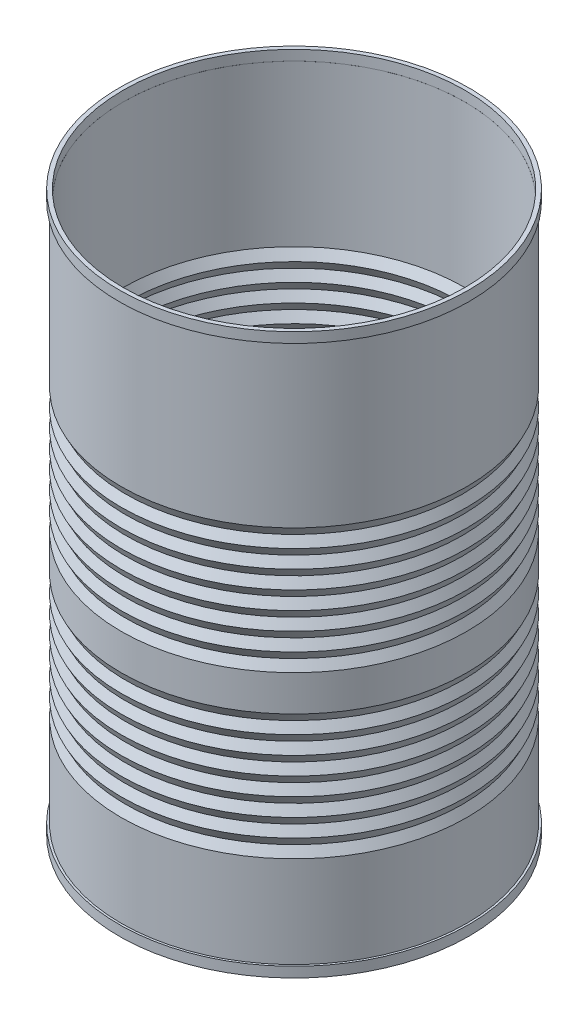
from build123d import *


with BuildPart() as part:
    # Sketch1 → Revolve1 (revolve)
    with BuildSketch(Plane.XY):
        with BuildLine():
            Line((0, 0), (16.383, 0))
            Line((16.383, 0), (19.177, -0.635))
            Line((19.177, -0.635), (24.1935, -0.635))
            ThreePointArc((24.1935, -0.635), (26.9875, -1.651), (29.7815, -0.635))
            Line((29.7815, -0.635), (30.7975, -0.635))
            ThreePointArc((30.7975, -0.635), (34.0995, -1.651), (37.4015, -0.635))
            Line((37.4015, -0.635), (52.65050938, -0.635))
            Line((52.65050938, -0.635), (52.65050938, -3.81))
            Line((52.65050938, -3.81), (54.58856494, -3.81))
            Line((54.58856494, -3.81), (54.58856494, -0.635))
            Line((54.58856494, -0.635), (53.94254642, -0.635))
            Line((53.94254642, -0.635), (53.94254642, 27.94))
            Line((53.94254642, 27.94), (52.48900475, 30.734))
            Line((52.48900475, 30.734), (53.94254642, 33.528))
            Line((53.94254642, 33.528), (52.48900475, 36.322))
            Line((52.48900475, 36.322), (53.94254642, 39.116))
            Line((53.94254642, 39.116), (52.48900475, 41.91))
            Line((52.48900475, 41.91), (53.94254642, 44.704))
            Line((53.94254642, 44.704), (52.48900475, 47.498))
            Line((52.48900475, 47.498), (53.94254642, 50.292))
            Line((53.94254642, 50.292), (52.48900475, 53.086))
            Line((52.48900475, 53.086), (53.94254642, 55.88))
            Line((53.94254642, 55.88), (52.48900475, 58.674))
            Line((52.48900475, 58.674), (53.94254642, 61.468))
            Line((53.94254642, 61.468), (52.48900475, 64.262))
            Line((52.48900475, 64.262), (53.94254642, 67.056))
            Line((53.94254642, 67.056), (53.94254642, 78.232))
            Line((53.94254642, 78.232), (52.48900475, 81.026))
            Line((52.48900475, 81.026), (53.94254642, 83.82))
            Line((53.94254642, 83.82), (52.48900475, 86.614))
            Line((52.48900475, 86.614), (53.94254642, 89.408))
            Line((53.94254642, 89.408), (52.48900475, 92.202))
            Line((52.48900475, 92.202), (53.94254642, 94.996))
            Line((53.94254642, 94.996), (52.48900475, 97.79))
            Line((52.48900475, 97.79), (53.94254642, 100.584))
            Line((53.94254642, 100.584), (52.48900475, 103.378))
            Line((52.48900475, 103.378), (53.94254642, 106.172))
            Line((53.94254642, 106.172), (52.48900475, 108.966))
            Line((52.48900475, 108.966), (53.94254642, 111.76))
            Line((53.94254642, 111.76), (52.48900475, 114.554))
            Line((52.48900475, 114.554), (53.94254642, 117.348))
            Line((53.94254642, 117.348), (53.94254642, 167.64))
            Line((53.94254642, 167.64), (54.58856494, 167.64))
            Line((54.58856494, 167.64), (54.58856494, 170.815))
            Line((54.58856494, 170.815), (53.31856494, 170.815))
            Line((53.31856494, 170.815), (53.31856494, 167.64))
            Line((53.31856494, 167.64), (53.30754642, 167.64))
            Line((53.30754642, 167.64), (53.30754642, 117.503296069))
            Line((53.30754642, 117.503296069), (51.773214017, 114.554))
            Line((51.773214017, 114.554), (53.226755687, 111.76))
            Line((53.226755687, 111.76), (51.773214017, 108.966))
            Line((51.773214017, 108.966), (53.226755687, 106.172))
            Line((53.226755687, 106.172), (51.773214017, 103.378))
            Line((51.773214017, 103.378), (53.226755687, 100.584))
            Line((53.226755687, 100.584), (51.773214017, 97.79))
            Line((51.773214017, 97.79), (53.226755687, 94.996))
            Line((53.226755687, 94.996), (51.773214017, 92.202))
            Line((51.773214017, 92.202), (53.226755687, 89.408))
            Line((53.226755687, 89.408), (51.773214017, 86.614))
            Line((51.773214017, 86.614), (53.226755687, 83.82))
            Line((53.226755687, 83.82), (51.773214017, 81.026))
            Line((51.773214017, 81.026), (53.30754642, 78.076703931))
            Line((53.30754642, 78.076703931), (53.30754642, 67.211296069))
            Line((53.30754642, 67.211296069), (51.773214017, 64.262))
            Line((51.773214017, 64.262), (53.226755687, 61.468))
            Line((53.226755687, 61.468), (51.773214017, 58.674))
            Line((51.773214017, 58.674), (53.226755687, 55.88))
            Line((53.226755687, 55.88), (51.773214017, 53.086))
            Line((51.773214017, 53.086), (53.226755687, 50.292))
            Line((53.226755687, 50.292), (51.773214017, 47.498))
            Line((51.773214017, 47.498), (53.226755687, 44.704))
            Line((53.226755687, 44.704), (51.773214017, 41.91))
            Line((51.773214017, 41.91), (53.226755687, 39.116))
            Line((53.226755687, 39.116), (51.773214017, 36.322))
            Line((51.773214017, 36.322), (53.226755687, 33.528))
            Line((53.226755687, 33.528), (51.773214017, 30.734))
            Line((51.773214017, 30.734), (53.30754642, 27.784703931))
            Line((53.30754642, 27.784703931), (53.30754642, 0))
            Line((53.30754642, 0), (37.199965126, 0))
            ThreePointArc((37.199965126, 0), (34.0995, -1.016), (30.999034874, 0))
            Line((30.999034874, 0), (29.540168408, 0))
            ThreePointArc((29.540168408, 0), (26.9875, -1.016), (24.434831592, 0))
            Line((24.434831592, 0), (19.2482506, 0))
            Line((19.2482506, 0), (16.4542506, 0.635))
            Line((16.4542506, 0.635), (0, 0.635))
            Line((0, 0.635), (0, 0))
        make_face()
    revolve(axis=Axis((0, -1000, 0), (0, 1, 0)))


solid = part.part
